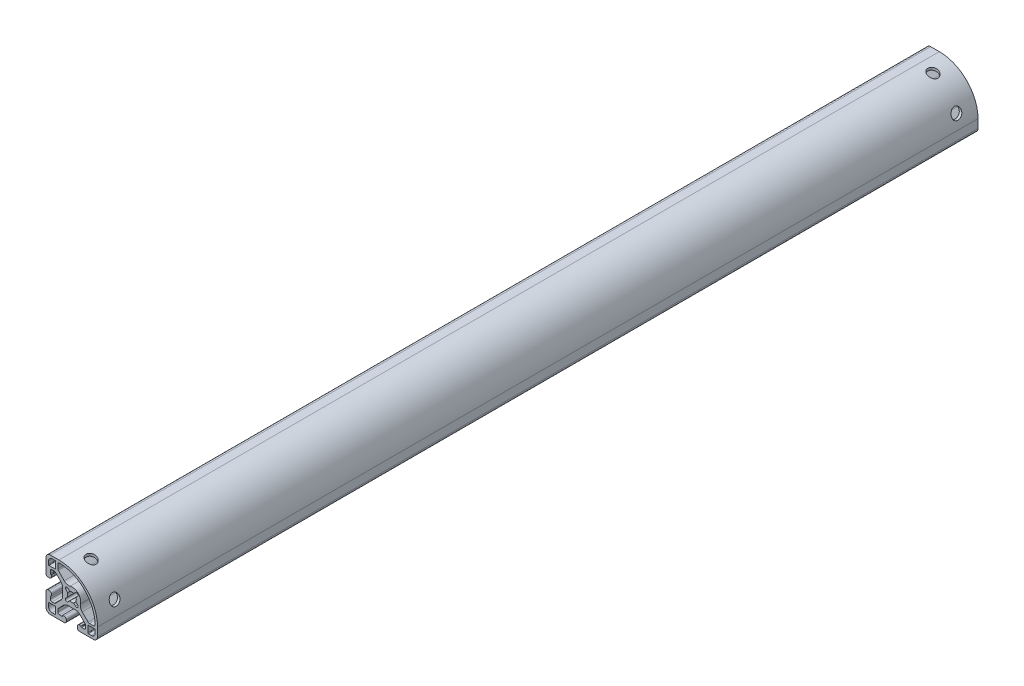
from build123d import *

# Parameters (mm, degrees)
EXTRUDE1_DEPTH             = 650.8496
SKETCH2_R                  = 3.7465
F_7050_R_LEFT_OPEN_DEPTH   = 653.242067273
SKETCH3_R                  = 3.7465
F_7050_S_LEFT_OPEN_DEPTH   = 653.242067381
SKETCH5_R                  = 3.7465
F_7050_R_LEFT_OPEN_2_DEPTH = 653.242067381
SKETCH4_R                  = 3.7465
F_7050_S_LEFT_OPEN_2_DEPTH = 653.242067381


with BuildPart() as part:
    # Sketch1 → Extrude1 (new body)
    with BuildSketch(Plane.XY):
        with BuildLine():
            Line((-7.239, -15.8242), (-9.017, -15.8242))
            ThreePointArc((-9.017, -15.8242), (-9.915025612, -15.452225612), (-10.287, -14.5542))
            Line((-10.287, -14.5542), (-10.287, -12.810497326))
            ThreePointArc((-10.287, -12.810497326), (-10.219328904, -12.470291755), (-10.026617928, -12.181879398))
            Line((-10.026617928, -12.181879398), (-5.973937506, -8.129198975))
            ThreePointArc((-5.973937506, -8.129198975), (-4.432991483, -7.09957176), (-2.615321716, -6.738014764))
            Line((-2.615321716, -6.738014764), (2.615321716, -6.738014764))
            ThreePointArc((2.615321716, -6.738014764), (4.432991483, -7.09957176), (5.973937506, -8.129198975))
            Line((5.973937506, -8.129198975), (10.026617928, -12.181879398))
            ThreePointArc((10.026617928, -12.181879398), (10.219328904, -12.470291755), (10.287, -12.810497326))
            Line((10.287, -12.810497326), (10.287, -14.5542))
            ThreePointArc((10.287, -14.5542), (9.915025612, -15.452225612), (9.017, -15.8242))
            Line((9.017, -15.8242), (7.239, -15.8242))
            ThreePointArc((7.239, -15.8242), (6.969592316, -15.712607684), (6.858, -15.4432))
            Line((6.858, -15.4432), (6.858, -14.986))
            Line((6.858, -14.986), (5.6388, -14.986))
            ThreePointArc((5.6388, -14.986), (4.525248241, -15.447248241), (4.064, -16.5608))
            Line((4.064, -16.5608), (4.064, -17.4752))
            ThreePointArc((4.064, -17.4752), (4.525248241, -18.588751759), (5.6388, -19.05))
            Line((5.6388, -19.05), (15.875, -19.05))
            ThreePointArc((15.875, -19.05), (18.12006403, -18.12006403), (19.05, -15.875))
            Line((19.05, -15.875), (19.05, -9.525))
            ThreePointArc((19.05, -9.525), (10.680576272, 10.680576272), (-9.525, 19.05))
            Line((-9.525, 19.05), (-15.875, 19.05))
            ThreePointArc((-15.875, 19.05), (-18.12006403, 18.12006403), (-19.05, 15.875))
            Line((-19.05, 15.875), (-19.05, 5.6388))
            ThreePointArc((-19.05, 5.6388), (-18.588751759, 4.525248241), (-17.4752, 4.064))
            Line((-17.4752, 4.064), (-16.5608, 4.064))
            ThreePointArc((-16.5608, 4.064), (-15.447248241, 4.525248241), (-14.986, 5.6388))
            Line((-14.986, 5.6388), (-14.986, 6.858))
            Line((-14.986, 6.858), (-15.4432, 6.858))
            ThreePointArc((-15.4432, 6.858), (-15.712607684, 6.969592316), (-15.8242, 7.239))
            Line((-15.8242, 7.239), (-15.8242, 9.017))
            ThreePointArc((-15.8242, 9.017), (-15.452225612, 9.915025612), (-14.5542, 10.287))
            Line((-14.5542, 10.287), (-12.810497326, 10.287))
            ThreePointArc((-12.810497326, 10.287), (-12.470291755, 10.219328904), (-12.181879398, 10.026617928))
            Line((-12.181879398, 10.026617928), (-8.129198975, 5.973937506))
            ThreePointArc((-8.129198975, 5.973937506), (-7.09957176, 4.432991483), (-6.738014764, 2.615321716))
            Line((-6.738014764, 2.615321716), (-6.738014764, -2.615321716))
            ThreePointArc((-6.738014764, -2.615321716), (-7.09957176, -4.432991483), (-8.129198975, -5.973937506))
            Line((-8.129198975, -5.973937506), (-12.181879398, -10.026617928))
            ThreePointArc((-12.181879398, -10.026617928), (-12.470291755, -10.219328904), (-12.810497326, -10.287))
            Line((-12.810497326, -10.287), (-14.5542, -10.287))
            ThreePointArc((-14.5542, -10.287), (-15.452225612, -9.915025612), (-15.8242, -9.017))
            Line((-15.8242, -9.017), (-15.8242, -7.239))
            ThreePointArc((-15.8242, -7.239), (-15.712607684, -6.969592316), (-15.4432, -6.858))
            Line((-15.4432, -6.858), (-14.986, -6.858))
            Line((-14.986, -6.858), (-14.986, -5.6388))
            ThreePointArc((-14.986, -5.6388), (-15.447248241, -4.525248241), (-16.5608, -4.064))
            Line((-16.5608, -4.064), (-17.4752, -4.064))
            ThreePointArc((-17.4752, -4.064), (-18.588751759, -4.525248241), (-19.05, -5.6388))
            Line((-19.05, -5.6388), (-19.05, -15.875))
            ThreePointArc((-19.05, -15.875), (-18.12006403, -18.12006403), (-15.875, -19.05))
            Line((-15.875, -19.05), (-5.6388, -19.05))
            ThreePointArc((-5.6388, -19.05), (-4.525248241, -18.588751759), (-4.064, -17.4752))
            Line((-4.064, -17.4752), (-4.064, -16.5608))
            ThreePointArc((-4.064, -16.5608), (-4.525248241, -15.447248241), (-5.6388, -14.986))
            Line((-5.6388, -14.986), (-6.858, -14.986))
            Line((-6.858, -14.986), (-6.858, -15.4432))
            ThreePointArc((-6.858, -15.4432), (-6.969592316, -15.712607684), (-7.239, -15.8242))
        make_face()
        with BuildLine():
            Line((-3.017877069, 1.401430967), (-4.338822982, 2.72237688))
            ThreePointArc((-4.338822982, 2.72237688), (-4.338822982, 4.338822982), (-2.72237688, 4.338822982))
            Line((-2.72237688, 4.338822982), (-1.401430967, 3.017877069))
            ThreePointArc((-1.401430967, 3.017877069), (0, 3.3274), (1.401430967, 3.017877069))
            Line((1.401430967, 3.017877069), (2.72237688, 4.338822982))
            ThreePointArc((2.72237688, 4.338822982), (4.338822982, 4.338822982), (4.338822982, 2.72237688))
            Line((4.338822982, 2.72237688), (3.017877069, 1.401430967))
            ThreePointArc((3.017877069, 1.401430967), (3.3274, 0), (3.017877069, -1.401430967))
            Line((3.017877069, -1.401430967), (4.338822982, -2.72237688))
            ThreePointArc((4.338822982, -2.72237688), (4.338822982, -4.338822982), (2.72237688, -4.338822982))
            Line((2.72237688, -4.338822982), (1.401430967, -3.017877069))
            ThreePointArc((1.401430967, -3.017877069), (0, -3.3274), (-1.401430967, -3.017877069))
            Line((-1.401430967, -3.017877069), (-2.72237688, -4.338822982))
            ThreePointArc((-2.72237688, -4.338822982), (-4.338822982, -4.338822982), (-4.338822982, -2.72237688))
            Line((-4.338822982, -2.72237688), (-3.017877069, -1.401430967))
            ThreePointArc((-3.017877069, -1.401430967), (-3.3274, 0), (-3.017877069, 1.401430967))
        make_face(mode=Mode.SUBTRACT)
        with BuildLine():
            Line((-11.8618, 16.8656), (-11.8618, 12.2428))
            ThreePointArc((-11.8618, 12.2428), (-11.973392316, 11.973392316), (-12.2428, 11.8618))
            Line((-12.2428, 11.8618), (-16.8656, 11.8618))
            ThreePointArc((-16.8656, 11.8618), (-17.135007684, 11.973392316), (-17.2466, 12.2428))
            Line((-17.2466, 12.2428), (-17.2466, 14.4526))
            ThreePointArc((-17.2466, 14.4526), (-16.428256347, 16.428256347), (-14.4526, 17.2466))
            Line((-14.4526, 17.2466), (-12.2428, 17.2466))
            ThreePointArc((-12.2428, 17.2466), (-11.973392316, 17.135007684), (-11.8618, 16.8656))
        make_face(mode=Mode.SUBTRACT)
        with BuildLine():
            Line((11.8618, -16.8656), (11.8618, -12.2428))
            ThreePointArc((11.8618, -12.2428), (11.973392316, -11.973392316), (12.2428, -11.8618))
            Line((12.2428, -11.8618), (16.8656, -11.8618))
            ThreePointArc((16.8656, -11.8618), (17.135007684, -11.973392316), (17.2466, -12.2428))
            Line((17.2466, -12.2428), (17.2466, -14.4526))
            ThreePointArc((17.2466, -14.4526), (16.428256347, -16.428256347), (14.4526, -17.2466))
            Line((14.4526, -17.2466), (12.2428, -17.2466))
            ThreePointArc((12.2428, -17.2466), (11.973392316, -17.135007684), (11.8618, -16.8656))
        make_face(mode=Mode.SUBTRACT)
        with BuildLine():
            Line((-16.8656, -11.8618), (-12.2428, -11.8618))
            ThreePointArc((-12.2428, -11.8618), (-11.973392316, -11.973392316), (-11.8618, -12.2428))
            Line((-11.8618, -12.2428), (-11.8618, -16.8656))
            ThreePointArc((-11.8618, -16.8656), (-11.973392316, -17.135007684), (-12.2428, -17.2466))
            Line((-12.2428, -17.2466), (-14.4526, -17.2466))
            ThreePointArc((-14.4526, -17.2466), (-16.428256347, -16.428256347), (-17.2466, -14.4526))
            Line((-17.2466, -14.4526), (-17.2466, -12.2428))
            ThreePointArc((-17.2466, -12.2428), (-17.135007684, -11.973392316), (-16.8656, -11.8618))
        make_face(mode=Mode.SUBTRACT)
        with BuildLine():
            Line((-5.566848938, 7.722110407), (-9.915025612, 12.070287081))
            ThreePointArc((-9.915025612, 12.070287081), (-10.190327006, 12.482304734), (-10.287, 12.968312693))
            Line((-10.287, 12.968312693), (-10.287, 15.982384095))
            ThreePointArc((-10.287, 15.982384095), (-9.90603998, 16.889306315), (-8.991711947, 17.252132304))
            ThreePointArc((-8.991711947, 17.252132304), (9.413046501, 9.413046501), (17.252132304, -8.991711947))
            ThreePointArc((17.252132304, -8.991711947), (16.889306315, -9.90603998), (15.982384095, -10.287))
            Line((15.982384095, -10.287), (12.968312693, -10.287))
            ThreePointArc((12.968312693, -10.287), (12.482304734, -10.190327006), (12.070287081, -9.915025612))
            Line((12.070287081, -9.915025612), (7.722110407, -5.566848938))
            ThreePointArc((7.722110407, -5.566848938), (6.514357723, -3.515474139), (6.453592272, -1.135744602))
            ThreePointArc((6.453592272, -1.135744602), (4.764495931, 4.764495931), (-1.135744602, 6.453592272))
            ThreePointArc((-1.135744602, 6.453592272), (-3.515474139, 6.514357723), (-5.566848938, 7.722110407))
        make_face(mode=Mode.SUBTRACT)
    extrude(amount=-EXTRUDE1_DEPTH)

    # Sketch2 → 7050-R-LEFT-OPEN (cut, through all)
    with BuildSketch(Plane.XZ.offset(19.05)):
        with Locations(Location((0, -14.2748, 0), (0, 0, 270))):
            Circle(SKETCH2_R)
    extrude(amount=-F_7050_R_LEFT_OPEN_DEPTH, mode=Mode.SUBTRACT)

    # Sketch3 → 7050-S-LEFT-OPEN (cut, through all)
    with BuildSketch(Plane.ZY.offset(19.05)):
        with Locations(Location((-14.2748, 0, 0), (0, 0, 342.353212258))):
            Circle(SKETCH3_R)
    extrude(amount=-F_7050_S_LEFT_OPEN_DEPTH, mode=Mode.SUBTRACT)

    # Sketch5 → 7050-R-LEFT-OPEN-2 (cut, through all)
    with BuildSketch(Plane.XZ.offset(19.05)):
        with Locations(Location((0, -636.5748, 0), (0, 0, 270))):
            Circle(SKETCH5_R)
    extrude(amount=-F_7050_R_LEFT_OPEN_2_DEPTH, mode=Mode.SUBTRACT)

    # Sketch4 → 7050-S-LEFT-OPEN-2 (cut, through all)
    with BuildSketch(Plane.ZY.offset(19.05)):
        with Locations(Location((-636.5748, 0, 0), (0, 0, 342.353212258))):
            Circle(SKETCH4_R)
    extrude(amount=-F_7050_S_LEFT_OPEN_2_DEPTH, mode=Mode.SUBTRACT)


solid = part.part
